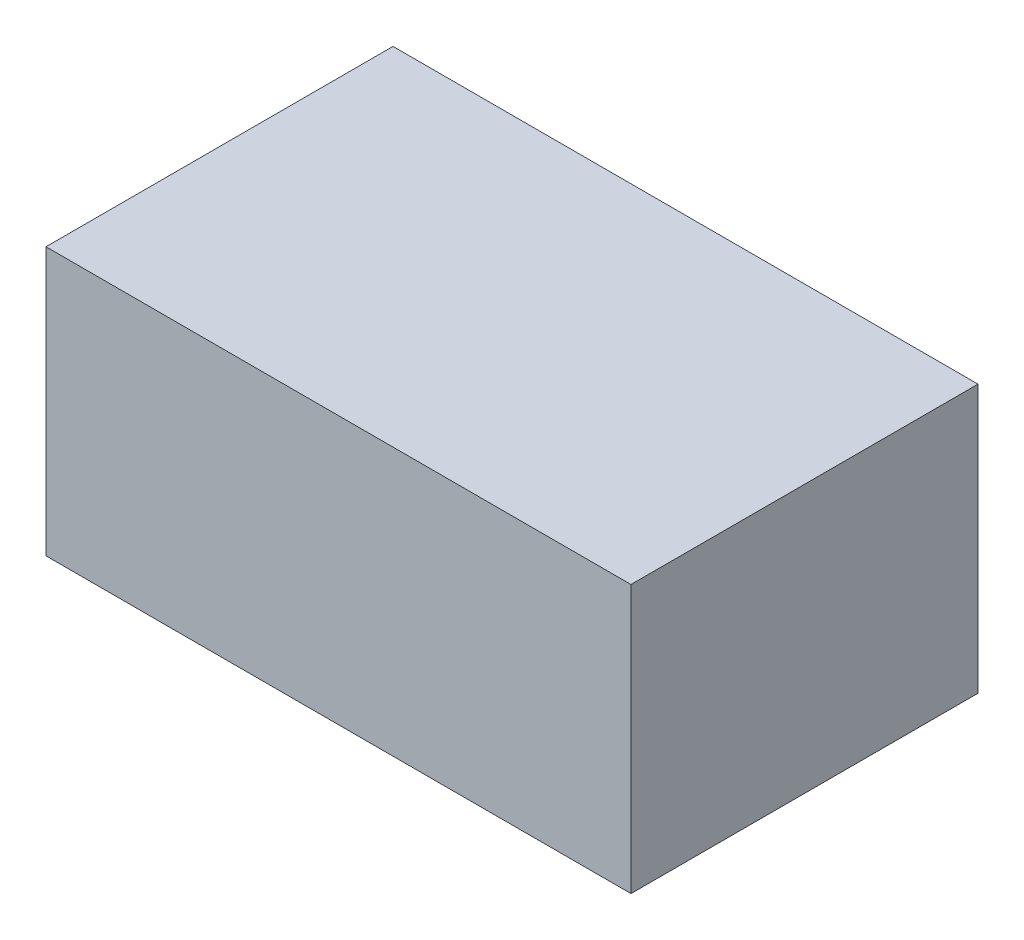
from build123d import *

# Parameters (mm, degrees)
SKETCH1_W           = 59
SKETCH1_H           = 27
BOSS_EXTRUDE1_DEPTH = 35


with BuildPart() as part:
    # Sketch1 → Boss-Extrude1 (new body)
    with BuildSketch(Plane.XY):
        Rectangle(SKETCH1_W, SKETCH1_H)
    extrude(amount=BOSS_EXTRUDE1_DEPTH)


solid = part.part
